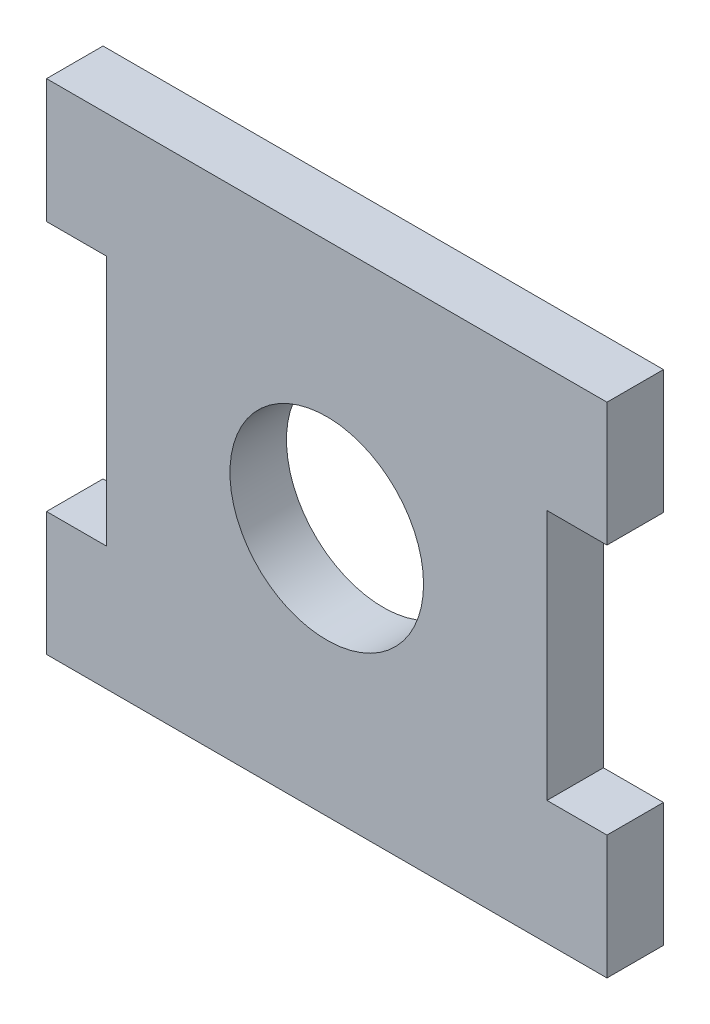
from build123d import *

# Parameters (mm, degrees)
SKETCH1_R           = 9.7917
BOSS_EXTRUDE1_DEPTH = 5.715


with BuildPart() as part:
    # Sketch1 → Boss-Extrude1 (new body)
    with BuildSketch(Plane.XY):
        Polygon((0, 0), (56.6928, 0), (56.6928, 12.5222), (50.6222, 12.5222), (50.6222, 37.9222), (56.6928, 37.9222), (56.6928, 50.4444), (0, 50.4444), (0, 37.9222), (6.0706, 37.9222), (6.0706, 12.5222), (0, 12.5222), align=None)
        with Locations((28.3464, 25.2222)):
            Circle(SKETCH1_R, mode=Mode.SUBTRACT)
    extrude(amount=BOSS_EXTRUDE1_DEPTH)


solid = part.part
